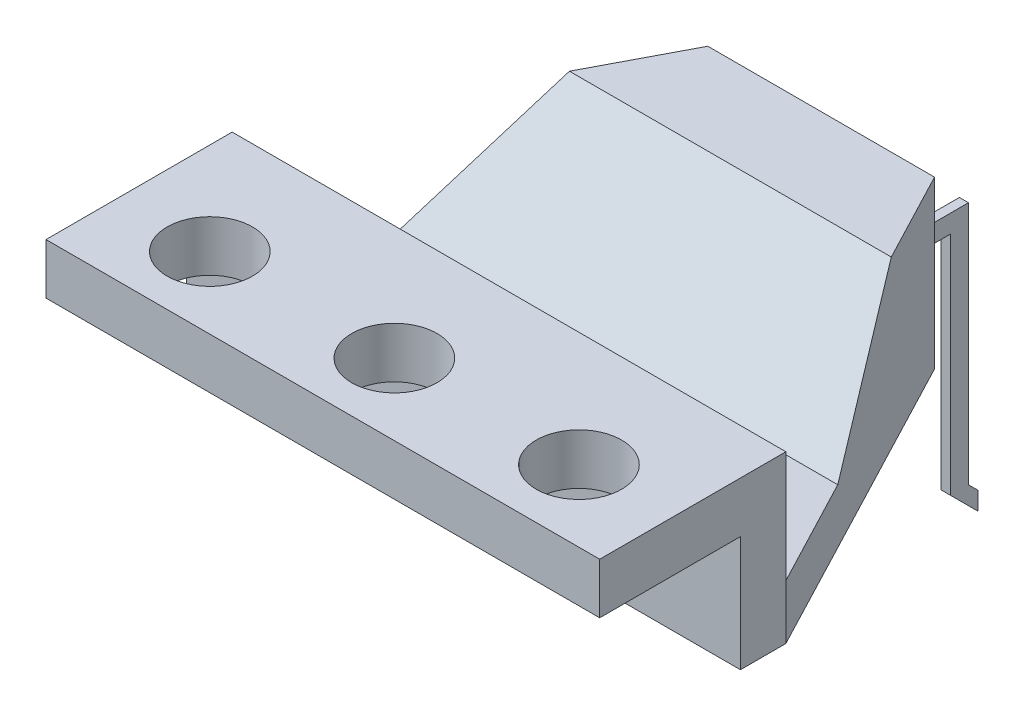
from build123d import *

# Parameters (mm, degrees)
BOSS_EXTRUDE1_DEPTH = 30.48
SKETCH2_R           = 2.3495
CUT_EXTRUDE1_DEPTH  = 10
BOSS_EXTRUDE2_START = 14.99
BOSS_EXTRUDE2_DEPTH = 0.5


with BuildPart() as part:
    # Sketch1 → Boss-Extrude1 (new body)
    with BuildSketch(Plane(origin=(0, 0, 0), x_dir=(0, 0, -1), z_dir=(1, 0, 0))):
        Polygon((10.247, 0), (0, 0), (0, -2.794), (7.747, -2.794), (7.747, -9.144), (27.432, -9.144), (27.432, -8.144), (27.432, 0), (22.432, 0), (16.247, -6.144), (10.247, -6.144), align=None)
    extrude(amount=BOSS_EXTRUDE1_DEPTH)

    # Sketch2 → Cut-Extrude1 (cut)
    with BuildSketch(Plane(origin=(0, 0, 0), x_dir=(1, 0, 0), z_dir=(0, 1, 0))):
        with Locations((5.08, 3.937)):
            Circle(SKETCH2_R)
        with Locations((15.24, 3.937)):
            Circle(SKETCH2_R)
        with Locations((25.4, 3.937)):
            Circle(SKETCH2_R)
        Polygon((9, 27.432), (0, 10.247), (0, 27.432), align=None)
        Polygon((21.48, 27.432), (30.48, 10.247), (30.48, 27.432), align=None)
    extrude(amount=-CUT_EXTRUDE1_DEPTH, mode=Mode.SUBTRACT)

    # Sketch1<4> → Boss-Extrude2 (add)
    with BuildSketch(Plane(origin=(0, 0, 0), x_dir=(0, 0, -1), z_dir=(1, 0, 0)).offset(BOSS_EXTRUDE2_START)):
        Polygon((27.432, -8.144), (27.432, -9.144), (34.29, -9.144), (34.29, -21.59), (35.814, -23.114), (35.814, -22.114), (35.29, -21.59), (35.29, -8.144), align=None)
    extrude(amount=BOSS_EXTRUDE2_DEPTH)


solid = part.part
